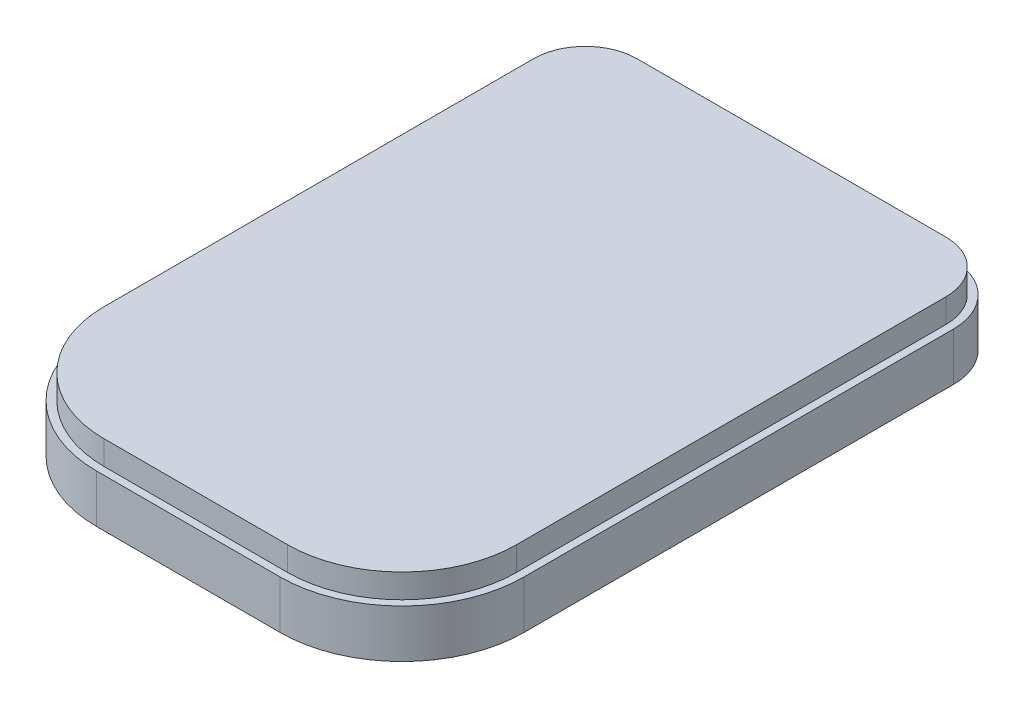
from build123d import *

# Parameters (mm, degrees)
BOSS_EXTRUDE1_DEPTH = 10
BOSS_EXTRUDE2_DEPTH = 5


with BuildPart() as part:
    # Sketch1 → Boss-Extrude1 (new body)
    with BuildSketch(Plane(origin=(0, 0, 0), x_dir=(1, 0, 0), z_dir=(0, 1, 0))):
        with BuildLine():
            Line((32.11260948, 63.5), (-32.11260948, 63.5))
            ThreePointArc((-32.11260948, 63.5), (-40.836461979, 59.886461979), (-44.45, 51.16260948))
            Line((-44.45, 51.16260948), (-44.45, -38.1))
            ThreePointArc((-44.45, -38.1), (-37.010512242, -56.060512242), (-19.05, -63.5))
            Line((-19.05, -63.5), (19.05, -63.5))
            ThreePointArc((19.05, -63.5), (37.010512242, -56.060512242), (44.45, -38.1))
            Line((44.45, -38.1), (44.45, 51.16260948))
            ThreePointArc((44.45, 51.16260948), (40.836461979, 59.886461979), (32.11260948, 63.5))
        make_face()
    extrude(amount=BOSS_EXTRUDE1_DEPTH)

    # Sketch2 → Boss-Extrude2 (add)
    with BuildSketch(Plane(origin=(0, 10, 0), x_dir=(1, 0, 0), z_dir=(0, 1, 0))):
        with BuildLine():
            Line((-42.8625, 51.16260948), (-42.8625, -38.1))
            ThreePointArc((-42.8625, -38.1), (-35.887980227, -54.937980227), (-19.05, -61.9125))
            Line((-19.05, -61.9125), (19.05, -61.9125))
            ThreePointArc((19.05, -61.9125), (35.887980227, -54.937980227), (42.8625, -38.1))
            Line((42.8625, -38.1), (42.8625, 51.16260948))
            ThreePointArc((42.8625, 51.16260948), (39.713929964, 58.763929964), (32.11260948, 61.9125))
            Line((32.11260948, 61.9125), (-32.11260948, 61.9125))
            ThreePointArc((-32.11260948, 61.9125), (-39.713929964, 58.763929964), (-42.8625, 51.16260948))
        make_face()
    extrude(amount=BOSS_EXTRUDE2_DEPTH)


solid = part.part
